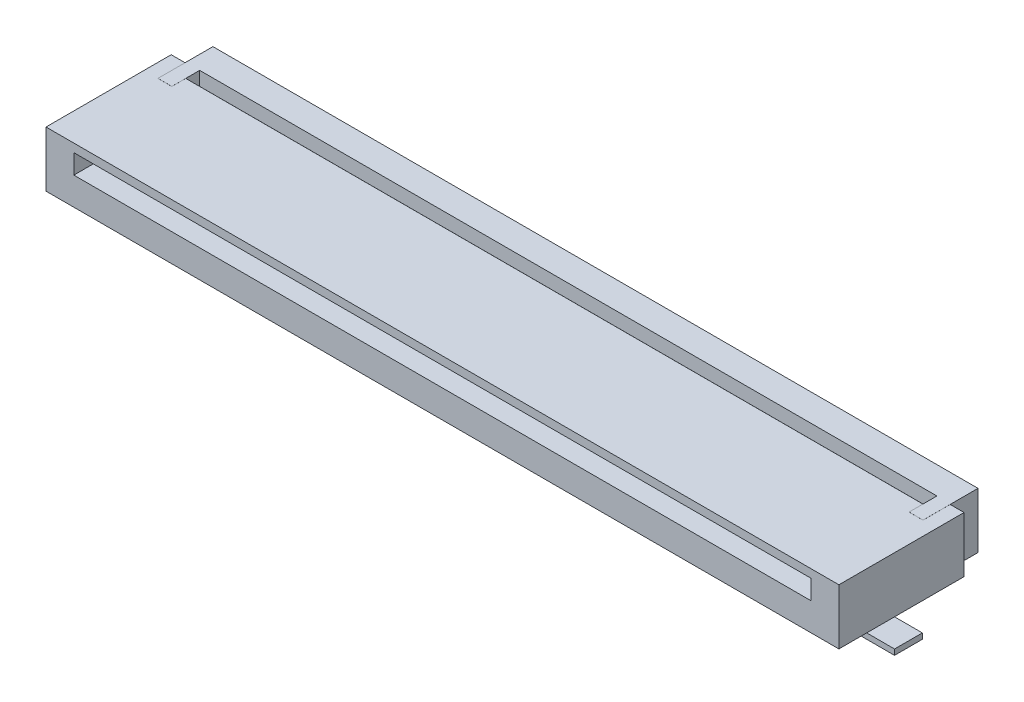
from build123d import *

# Parameters (mm, degrees)
SKETCH_1_W          = 28.5
SKETCH_1_H          = 5.5
EXTRUDE_1_DEPTH     = 2
SKETCH_2_W          = 0.5
SKETCH_2_H          = 1
CUT_EXTRUDE_1_DEPTH = 15.650085324
SKETCH_4_W          = 2
SKETCH_4_H          = 1
EXTRUDE_2_DEPTH     = 0.2
SKETCH_5_W          = 26.5
SKETCH_5_H          = 0.2
EXTRUDE_3_DEPTH     = 0.3
SKETCH_6_W          = 26.5
SKETCH_6_H          = 0.7
CUT_EXTRUDE_2_DEPTH = 4.5
CUT_EXTRUDE_3_DEPTH = 0.002
SKETCH_8_W          = 26.5
SKETCH_8_H          = 0.5
CUT_EXTRUDE_4_DEPTH = 0.5


with BuildPart() as part:
    # 草图1 → 凸台-拉伸1 (new body)
    with BuildSketch(Plane(origin=(0, 0, 0), x_dir=(1, 0, 0), z_dir=(0, 1, 0))):
        Rectangle(SKETCH_1_W, SKETCH_1_H)
    extrude(amount=EXTRUDE_1_DEPTH)

    # 草图2 → 切除-拉伸1 (cut, through all)
    with BuildSketch(Plane(origin=(0, 2, 0), x_dir=(1, 0, 0), z_dir=(0, 1, 0))):
        with Locations((-14, 2.25)):
            Rectangle(SKETCH_2_W, SKETCH_2_H)
        with Locations((14, 2.25)):
            Rectangle(SKETCH_2_W, SKETCH_2_H)
    extrude(amount=-CUT_EXTRUDE_1_DEPTH, mode=Mode.SUBTRACT)

    # 草图4 → 凸台-拉伸2 (add)
    with BuildSketch(Plane.XZ):
        with Locations((-14.25, 1.25)):
            Rectangle(SKETCH_4_W, SKETCH_4_H)
        with Locations((14.25, 1.25)):
            Rectangle(SKETCH_4_W, SKETCH_4_H)
    extrude(amount=EXTRUDE_2_DEPTH)

    # 草图5 → 凸台-拉伸3 (add)
    with BuildSketch(Plane.XZ):
        with Locations((0, -2.45)):
            Rectangle(SKETCH_5_W, SKETCH_5_H)
    extrude(amount=EXTRUDE_3_DEPTH)

    # 草图6 → 切除-拉伸2 (cut)
    with BuildSketch(Plane.XY.offset(2.75)):
        with Locations((0, 1.35)):
            Rectangle(SKETCH_6_W, SKETCH_6_H)
    extrude(amount=-CUT_EXTRUDE_2_DEPTH, mode=Mode.SUBTRACT)

    # 草图7 → 切除-拉伸3 (cut)
    with BuildSketch(Plane(origin=(0, 2, 0), x_dir=(1, 0, 0), z_dir=(0, 1, 0))):
        Polygon((-13.75, 1.75), (-13.75, 0.773341088), (-13.25, 0.773341088), (-13.25, 1.273341088), (13.25, 1.273341088), (13.25, 0.773341088), (13.75, 0.773341088), (13.75, 1.75), (14.25, 1.75), (14.25, -2.75), (-14.25, -2.75), (-14.25, 1.75), align=None)
    extrude(amount=-CUT_EXTRUDE_3_DEPTH, mode=Mode.SUBTRACT)

    # 草图8 → 切除-拉伸4 (cut)
    with BuildSketch(Plane(origin=(0, 2, 0), x_dir=(1, 0, 0), z_dir=(0, 1, 0))):
        with Locations((0, 1.523341088)):
            Rectangle(SKETCH_8_W, SKETCH_8_H)
    extrude(amount=-CUT_EXTRUDE_4_DEPTH, mode=Mode.SUBTRACT)


solid = part.part
